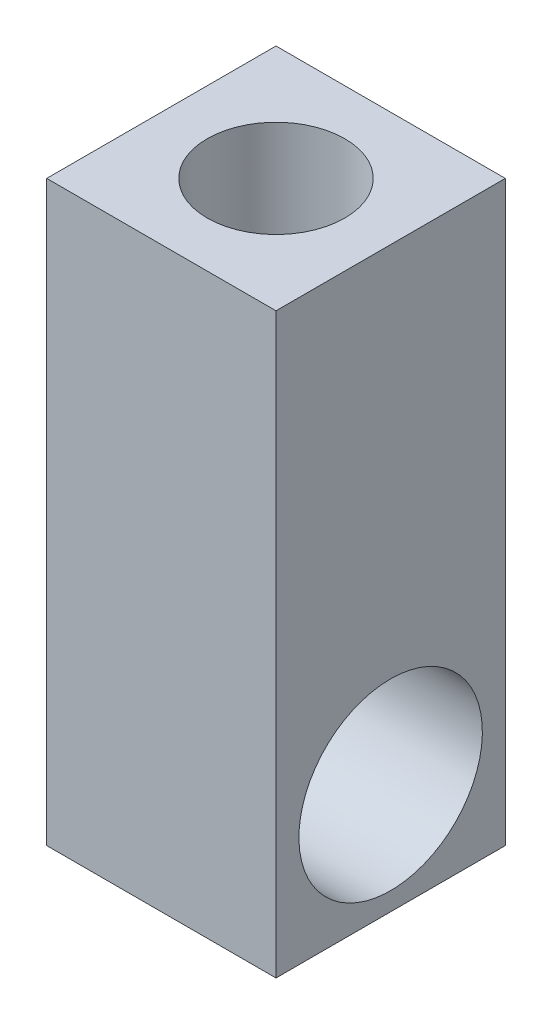
from build123d import *

# Parameters (mm, degrees)
SKETCH1_W           = 2.5
SKETCH1_H           = 10
BOSS_EXTRUDE1_DEPTH = 2.5
SKETCH2_R           = 0.75
CUT_EXTRUDE1_DEPTH  = 3
SKETCH3_R           = 1
CUT_EXTRUDE3_DEPTH  = 7.5
SKETCH4_W           = 2.5
SKETCH4_H           = 2.5
CUT_EXTRUDE5_DEPTH  = 2
SKETCH6_R           = 0.75
CUT_EXTRUDE7_DEPTH  = 3
SKETCH7_W           = 2.5
SKETCH7_H           = 2.5
CUT_EXTRUDE8_DEPTH  = 1
SKETCH8_R           = 0.75
CUT_EXTRUDE9_DEPTH  = 2.5
SKETCH9_W           = 2.5
SKETCH9_H           = 2.4
SKETCH9_R           = 1
CUT_EXTRUDE11_DEPTH = 10
BOSS_EXTRUDE2_START = -2.5
SKETCH10_R          = 1
SKETCH10_W          = 2.5
SKETCH10_H          = 2.4
BOSS_EXTRUDE2_DEPTH = 2.5
SKETCH11_R          = 1
CUT_EXTRUDE12_DEPTH = 2.5
BOSS_EXTRUDE3_START = -2.5
SKETCH12_R          = 1
BOSS_EXTRUDE3_DEPTH = 2.5
SKETCH13_W          = 2.5
SKETCH13_H          = 0.7
CUT_EXTRUDE13_DEPTH = 2.5
SKETCH14_R          = 1
CUT_EXTRUDE14_DEPTH = 2.5


with BuildPart() as part:
    # Sketch1 → Boss-Extrude1 (new body)
    with BuildSketch(Plane.XY):
        Rectangle(SKETCH1_W, SKETCH1_H)
    extrude(amount=BOSS_EXTRUDE1_DEPTH)

    # Sketch2 → Cut-Extrude1 (cut)
    with BuildSketch(Plane(origin=(0, 5, 0), x_dir=(1, 0, 0), z_dir=(0, 1, 0))):
        with Locations(Location((0, -1.25, 0), (0, 0, 270))):
            Circle(SKETCH2_R)
    extrude(amount=-CUT_EXTRUDE1_DEPTH, mode=Mode.SUBTRACT)

    # Sketch3 → Cut-Extrude3 (cut)
    with BuildSketch(Plane.ZY.offset(1.25)):
        with Locations(Location((1.25, -3.8, 0), (0, 0, 270))):
            Circle(SKETCH3_R)
    extrude(amount=-CUT_EXTRUDE3_DEPTH, mode=Mode.SUBTRACT)

    # Sketch4 → Cut-Extrude5 (cut)
    with BuildSketch(Plane(origin=(0, 5, 0), x_dir=(1, 0, 0), z_dir=(0, 1, 0))):
        with Locations((0, -1.25)):
            Rectangle(SKETCH4_W, SKETCH4_H)
    extrude(amount=-CUT_EXTRUDE5_DEPTH, mode=Mode.SUBTRACT)

    # Sketch6 → Cut-Extrude7 (cut)
    with BuildSketch(Plane(origin=(0, 3, 0), x_dir=(1, 0, 0), z_dir=(0, 1, 0))):
        with Locations(Location((0, -1.25, 0), (0, 0, 270))):
            Circle(SKETCH6_R)
    extrude(amount=-CUT_EXTRUDE7_DEPTH, mode=Mode.SUBTRACT)

    # Sketch7 → Cut-Extrude8 (cut)
    with BuildSketch(Plane(origin=(0, 3, 0), x_dir=(1, 0, 0), z_dir=(0, 1, 0))):
        with Locations((0, -1.25)):
            Rectangle(SKETCH7_W, SKETCH7_H)
    extrude(amount=-CUT_EXTRUDE8_DEPTH, mode=Mode.SUBTRACT)

    # Sketch8 → Cut-Extrude9 (cut)
    with BuildSketch(Plane(origin=(0, 0, 0), x_dir=(1, 0, 0), z_dir=(0, 1, 0))):
        with Locations(Location((0, -1.25, 0), (0, 0, 270))):
            Circle(SKETCH8_R)
    extrude(amount=-CUT_EXTRUDE9_DEPTH, mode=Mode.SUBTRACT)

    # Sketch9 → Cut-Extrude11 (cut)
    # profile 1 of 2: a face of its own
    with BuildSketch(Plane.ZY.offset(1.25)):
        with Locations((1.25, -3.8)):
            Rectangle(SKETCH9_W, SKETCH9_H)
        with Locations((1.25, -3.8)):
            Circle(SKETCH9_R, mode=Mode.SUBTRACT)
    # profile 2 of 2: a face of its own
    with BuildSketch(Plane.ZY.offset(1.25)):
        with Locations(Location((1.25, -1.4, 0), (0, 0, 270))):
            Circle(SKETCH9_R)
    extrude(amount=-CUT_EXTRUDE11_DEPTH, mode=Mode.SUBTRACT)

    # Sketch10 → Boss-Extrude2 (add)
    with BuildSketch(Plane(origin=(1.25, 0, 0), x_dir=(0, 0, -1), z_dir=(1, 0, 0)).offset(BOSS_EXTRUDE2_START)):
        with Locations((-1.25, -1.4)):
            Circle(SKETCH10_R)
        with Locations((-1.25, -3.8)):
            Rectangle(SKETCH10_W, SKETCH10_H)
    extrude(amount=BOSS_EXTRUDE2_DEPTH)

    # Sketch11 → Cut-Extrude12 (cut)
    with BuildSketch(Plane(origin=(1.25, 0, 0), x_dir=(0, 0, -1), z_dir=(1, 0, 0))):
        with Locations(Location((-1.25, -3.8, 0), (0, 0, 90))):
            Circle(SKETCH11_R)
    extrude(amount=-CUT_EXTRUDE12_DEPTH, mode=Mode.SUBTRACT)

    # Sketch12 → Boss-Extrude3 (add)
    with BuildSketch(Plane.ZY.offset(1.25).offset(BOSS_EXTRUDE3_START)):
        with Locations((1.25, -3.8)):
            Circle(SKETCH12_R)
    extrude(amount=BOSS_EXTRUDE3_DEPTH)

    # Sketch13 → Cut-Extrude13 (cut)
    with BuildSketch(Plane(origin=(1.25, 0, 0), x_dir=(0, 0, -1), z_dir=(1, 0, 0))):
        with Locations((-1.25, -4.65)):
            Rectangle(SKETCH13_W, SKETCH13_H)
    extrude(amount=-CUT_EXTRUDE13_DEPTH, mode=Mode.SUBTRACT)

    # Sketch14 → Cut-Extrude14 (cut)
    with BuildSketch(Plane(origin=(1.25, 0, 0), x_dir=(0, 0, -1), z_dir=(1, 0, 0))):
        with Locations(Location((-1.25, -3.1, 0), (0, 0, 90))):
            Circle(SKETCH14_R)
    extrude(amount=-CUT_EXTRUDE14_DEPTH, mode=Mode.SUBTRACT)


solid = part.part
